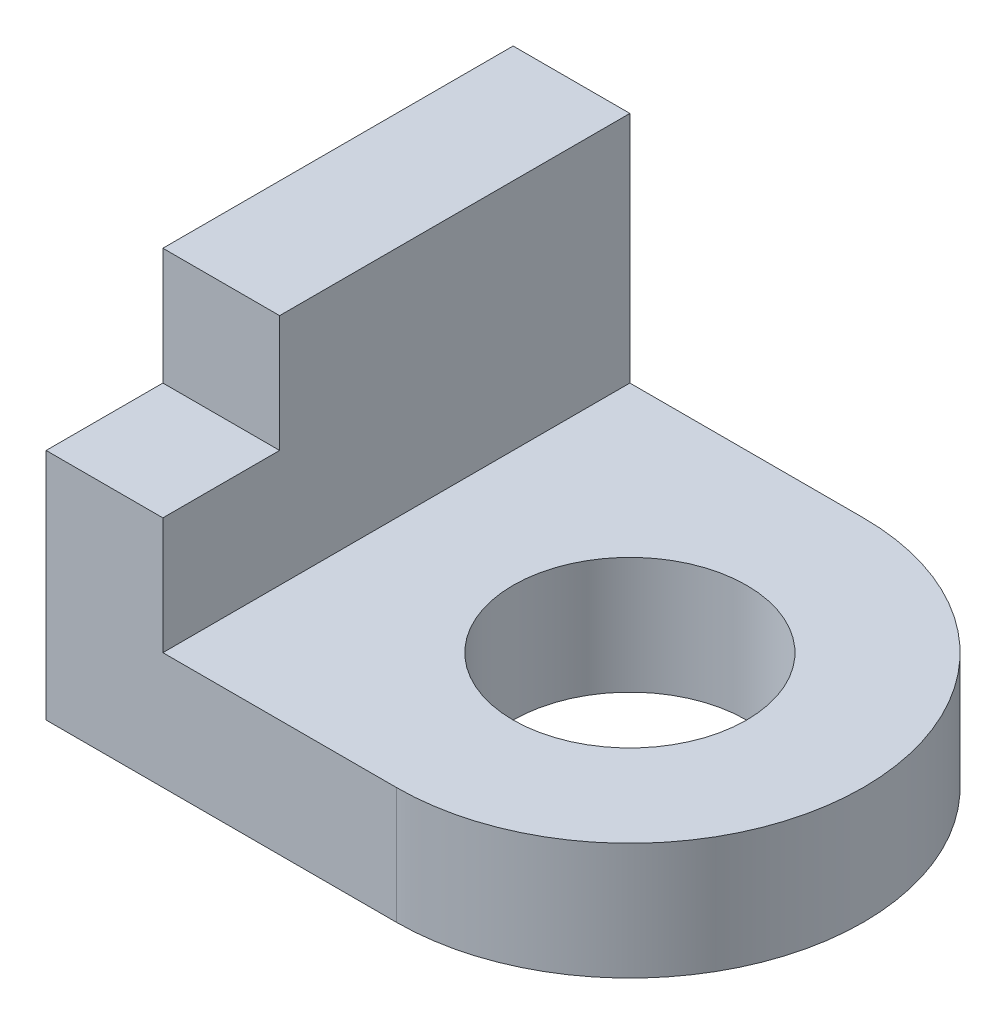
from build123d import *

# Parameters (mm, degrees)
SKETCH1_R           = 10
BOSS_EXTRUDE1_DEPTH = 10
BOSS_EXTRUDE2_DEPTH = 10


with BuildPart() as part:
    # Sketch1 → Boss-Extrude1 (new body)
    with BuildSketch(Plane(origin=(0, 0, 0), x_dir=(1, 0, 0), z_dir=(0, 1, 0))):
        with BuildLine():
            Line((0, 20), (-30, 20))
            Line((-30, 20), (-30, -20))
            Line((-30, -20), (0, -20))
            ThreePointArc((0, -20), (20, 0), (0, 20))
        make_face()
        with Locations(Location((0, 0, 0), (0, 0, 270))):
            Circle(SKETCH1_R, mode=Mode.SUBTRACT)
    extrude(amount=BOSS_EXTRUDE1_DEPTH)

    # Sketch2 → Boss-Extrude2 (add)
    with BuildSketch(Plane.ZY.offset(30)):
        Polygon((-20, 10), (-20, 30), (10, 30), (10, 20), (20, 20), (20, 10), align=None)
    extrude(amount=-BOSS_EXTRUDE2_DEPTH)


solid = part.part
